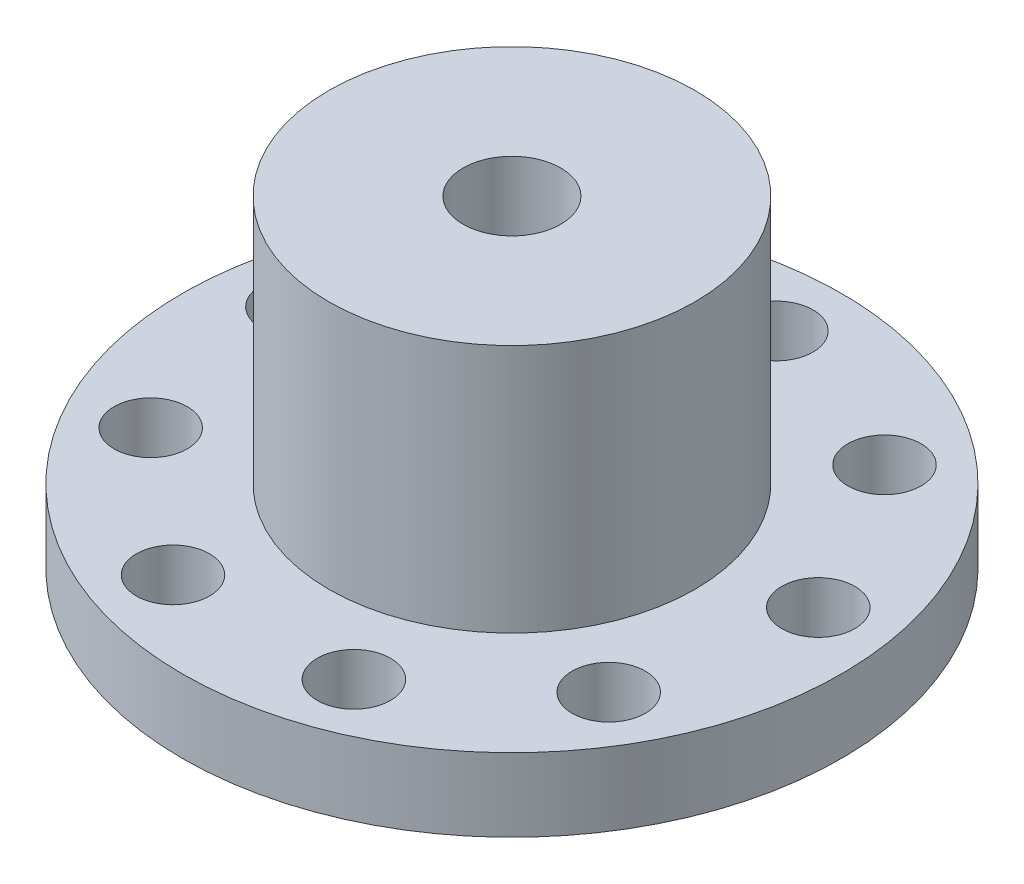
from build123d import *

# Parameters (mm, degrees)
SKETCH_1_R          = 27
SKETCH_1_R_2        = 3
SKETCH_1_R_3        = 4
EXTRUDE_1_DEPTH     = 6
SKETCH_3_R          = 15
SKETCH_3_R_2        = 4
EXTRUDE_2_DEPTH     = 20.4
SKETCH_5_R          = 2.5
CUT_EXTRUDE_1_DEPTH = 47.421546721


with BuildPart() as part:
    # 草图1 → 凸台-拉伸1 (new body)
    with BuildSketch(Plane(origin=(0, 0, 0), x_dir=(1, 0, 0), z_dir=(0, 1, 0))):
        with Locations(Location((0, 0, 0), (0, 0, 270))):
            Circle(SKETCH_1_R)
        with Locations(Location((0, 21.6648374, 0), (0, 0, 270))):
            Circle(SKETCH_1_R_2, mode=Mode.SUBTRACT)
        with Locations(Location((13.925889047, 16.596228301, 0), (0, 0, 270))):
            Circle(SKETCH_1_R_2, mode=Mode.SUBTRACT)
        with Locations(Location((21.335699839, 3.762059534, 0), (0, 0, 270))):
            Circle(SKETCH_1_R_2, mode=Mode.SUBTRACT)
        with Locations(Location((18.762299557, -10.8324187, 0), (0, 0, 270))):
            Circle(SKETCH_1_R_2, mode=Mode.SUBTRACT)
        with Locations(Location((7.409810793, -20.358287835, 0), (0, 0, 270))):
            Circle(SKETCH_1_R_2, mode=Mode.SUBTRACT)
        with Locations(Location((-7.409810793, -20.358287835, 0), (0, 0, 270))):
            Circle(SKETCH_1_R_2, mode=Mode.SUBTRACT)
        with Locations(Location((-18.762299557, -10.8324187, 0), (0, 0, 270))):
            Circle(SKETCH_1_R_2, mode=Mode.SUBTRACT)
        with Locations(Location((-21.335699839, 3.762059534, 0), (0, 0, 270))):
            Circle(SKETCH_1_R_2, mode=Mode.SUBTRACT)
        with Locations(Location((-13.925889047, 16.596228301, 0), (0, 0, 270))):
            Circle(SKETCH_1_R_2, mode=Mode.SUBTRACT)
        with Locations(Location((0, 0, 0), (0, 0, 270))):
            Circle(SKETCH_1_R_3, mode=Mode.SUBTRACT)
    extrude(amount=EXTRUDE_1_DEPTH)

    # 草图3 → 凸台-拉伸2 (add)
    with BuildSketch(Plane(origin=(0, 6, 0), x_dir=(1, 0, 0), z_dir=(0, 1, 0))):
        with Locations(Location((0, 0, 0), (0, 0, 270))):
            Circle(SKETCH_3_R)
        with Locations(Location((0, 0, 0), (0, 0, 270))):
            Circle(SKETCH_3_R_2, mode=Mode.SUBTRACT)
    extrude(amount=EXTRUDE_2_DEPTH)

    # 草图5 → 切除-拉伸1 (cut, through all)
    with BuildSketch(Plane(origin=(0, 0, 0), x_dir=(0, 1, 0), z_dir=(0, 0, 1))):
        with Locations((16.2, 0)):
            Circle(SKETCH_5_R)
    extrude(amount=-CUT_EXTRUDE_1_DEPTH, mode=Mode.SUBTRACT)


solid = part.part
